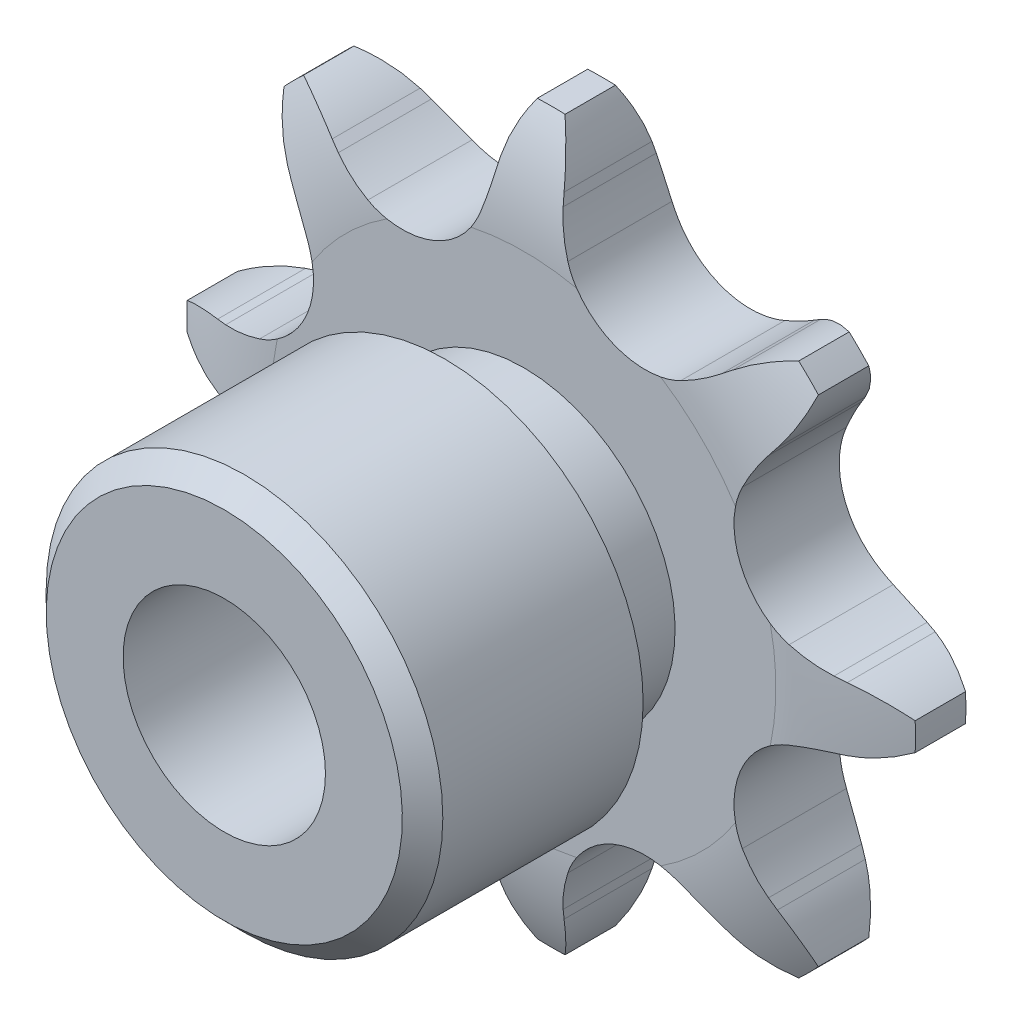
from build123d import *

# Parameters (mm, degrees)
CUT_EXTRUDE1_DEPTH      = 13.854131678
CIRPATTERN1_COUNT       = 8
BOSS_EXTRUDE1_START     = 1.3
SKETCH2_R               = 4.9
BOSS_EXTRUDE1_DEPTH     = 7.4
CUT_EXTRUDE2_DEPTH      = 16.467019907
CUT_EXTRUDE2_DEPTH_BACK = 16.467019907
SKETCH3_R               = 2.5
SKETCH4_W               = 1.95
SKETCH4_H               = 5.303262898
CUT_EXTRUDE3_DEPTH      = 16.467019907
CUT_EXTRUDE3_DEPTH_BACK = 16.467019907
SKETCH5_OUTSIDE_W       = 25.578
SKETCH5_OUTSIDE_H       = 25.578
SKETCH5_OUTSIDE_R       = 9


with BuildPart() as part:
    # Sketch1 → Revolve1 (revolve)
    with BuildSketch(Plane(origin=(0, 0, 0), x_dir=(0, 0, -1), z_dir=(1, 0, 0))):
        with BuildLine():
            Line((1.3, 0), (-1.3, 0))
            Line((-1.3, 0), (-1.3, 6.230168465))
            ThreePointArc((-1.3, 6.230168465), (-1.122370651, 7.67930614), (-0.6, 9.042640687))
            Line((-0.6, 9.042640687), (0.6, 9.042640687))
            ThreePointArc((0.6, 9.042640687), (1.122370651, 7.67930614), (1.3, 6.230168465))
            Line((1.3, 6.230168465), (1.3, 0))
        make_face()
    revolve(axis=Axis((0, 0, -1.3), (0, 0, 1)))

    # Sketch0 → Cut-Extrude1 (cut, symmetric)
    with BuildSketch(Plane.XY):
        with BuildLine():
            Line((4.947126229, -6.053047715), (4.732377345, -5.897023517))
            ThreePointArc((4.732377345, -5.897023517), (4.311233645, -5.620909609), (3.865564462, -5.386431708))
            ThreePointArc((3.865564462, -5.386431708), (2.216226062, -5.350443017), (1.075415543, -6.542149232))
            ThreePointArc((1.075415543, -6.542149232), (0.926080755, -7.023085846), (0.823529206, -7.51612143))
            Line((0.823529206, -7.51612143), (0.782004582, -7.77829759))
            ThreePointArc((0.782004582, -7.77829759), (-0.855606698, -10.189159874), (-3.756934176, -10.465432431))
            ThreePointArc((-3.756934176, -10.465432431), (4.255189061, -10.272935141), (10.056731872, -4.743624608))
            ThreePointArc((10.056731872, -4.743624608), (7.80982934, -6.599818743), (4.947126229, -6.053047715))
        make_face()
    cut_extrude1 = extrude(amount=CUT_EXTRUDE1_DEPTH, both=True, mode=Mode.SUBTRACT)

    # CirPattern1: Cut-Extrude1 ×8 about axis
    cirpattern1_axis = Axis((0, 0, 0), (0, 0, 1))
    for i in range(1, CIRPATTERN1_COUNT):
        add(cut_extrude1.rotate(cirpattern1_axis, i * 360 / CIRPATTERN1_COUNT), mode=Mode.SUBTRACT)

    # Sketch2 → Boss-Extrude1 (add)
    with BuildSketch(Plane.XY.offset(BOSS_EXTRUDE1_START)):
        with Locations(Location((0, 0, 0), (0, 0, 270))):
            Circle(SKETCH2_R)
    extrude(amount=BOSS_EXTRUDE1_DEPTH)

    # Sketch3 → Cut-Extrude2 (cut, two sides: drawn at the far end of the back side and taken through both)
    with BuildSketch(Plane.XY.offset(-CUT_EXTRUDE2_DEPTH_BACK)):
        Circle(SKETCH3_R)
    extrude(amount=CUT_EXTRUDE2_DEPTH + CUT_EXTRUDE2_DEPTH_BACK, mode=Mode.SUBTRACT)

    # Sketch4 → Cut-Revolve1 (revolve, cut)
    with BuildSketch(Plane(origin=(0, 0, 0), x_dir=(0, 0, -1), z_dir=(1, 0, 0))):
        Polygon((-8.7, 4.9), (-8.7, 4.4), (-8.2, 4.9), align=None)
        with Locations((-2.275, 6.391009238)):
            Rectangle(SKETCH4_W, SKETCH4_H)
    revolve(axis=Axis((0, 0, -1.3), (0, 0, 1)), mode=Mode.SUBTRACT)

    # Sketch5 outside → Cut-Extrude3 (cut, two sides: drawn at the far end of the back side and taken through both)
    with BuildSketch(Plane.XY.offset(-CUT_EXTRUDE3_DEPTH_BACK)):
        Rectangle(SKETCH5_OUTSIDE_W, SKETCH5_OUTSIDE_H)
        Circle(SKETCH5_OUTSIDE_R, mode=Mode.SUBTRACT)
    extrude(amount=CUT_EXTRUDE3_DEPTH + CUT_EXTRUDE3_DEPTH_BACK, mode=Mode.SUBTRACT)


solid = part.part
